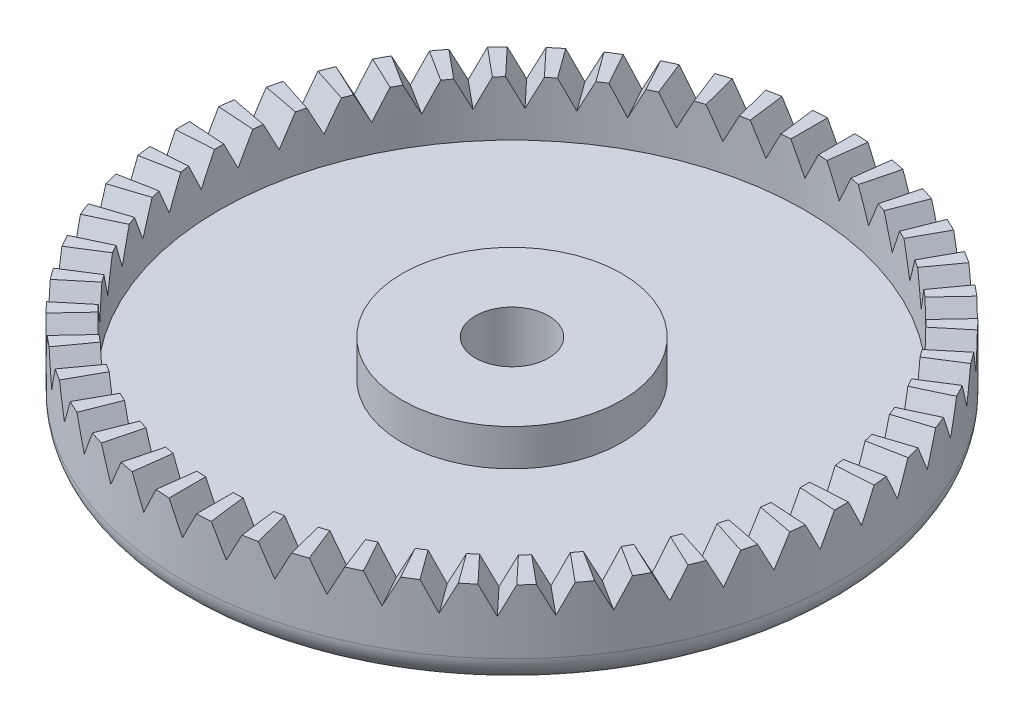
from build123d import *

# Parameters (mm, degrees)
ENL_V_START                  = 10
ENL_V_MAT_EXTRU_1_DEPTH      = 15
R_P_TITION_CIRCULAIRE1_COUNT = 50


with BuildPart() as part:
    # Esquisse1 → Révolution1 (revolve)
    with BuildSketch(Plane.XY, mode=Mode.PRIVATE) as r_volution1_sk:
        with BuildLine():
            Line((2, 0), (2, 11))
            Line((2, 11), (6, 11))
            Line((6, 11), (6, 9))
            Line((6, 9), (16, 9))
            Line((16, 9), (16, 12))
            Line((16, 12), (18, 12))
            Line((18, 12), (18, 8.5))
            ThreePointArc((18, 8.5), (17.560660172, 7.439339828), (16.5, 7))
            Line((16.5, 7), (4.75, 7))
            Line((4.75, 7), (4.75, 0))
            Line((4.75, 0), (2, 0))
        make_face()
    revolve(r_volution1_sk.sketch.rotate(Axis((0, 0, 0), (0, 1, 0)), 90), axis=Axis((0, 0, 0), (0, 1, 0)))

    # Esquisse2 → Enlèv. mat.-Extru.1 (cut)
    with BuildSketch(Plane.XY.offset(ENL_V_START)):
        Polygon((-0.75, 12), (0.75, 12), (0, 10.5), align=None)
    enl_v_mat_extru_1 = extrude(amount=ENL_V_MAT_EXTRU_1_DEPTH, mode=Mode.SUBTRACT)

    # Répétition circulaire1: Enlèv. mat.-Extru.1 ×50 about axis
    r_p_tition_circulaire1_axis = Axis((0, 0, 0), (0, 1, 0))
    for i in range(1, R_P_TITION_CIRCULAIRE1_COUNT):
        add(enl_v_mat_extru_1.rotate(r_p_tition_circulaire1_axis, i * 360 / R_P_TITION_CIRCULAIRE1_COUNT), mode=Mode.SUBTRACT)


solid = part.part
